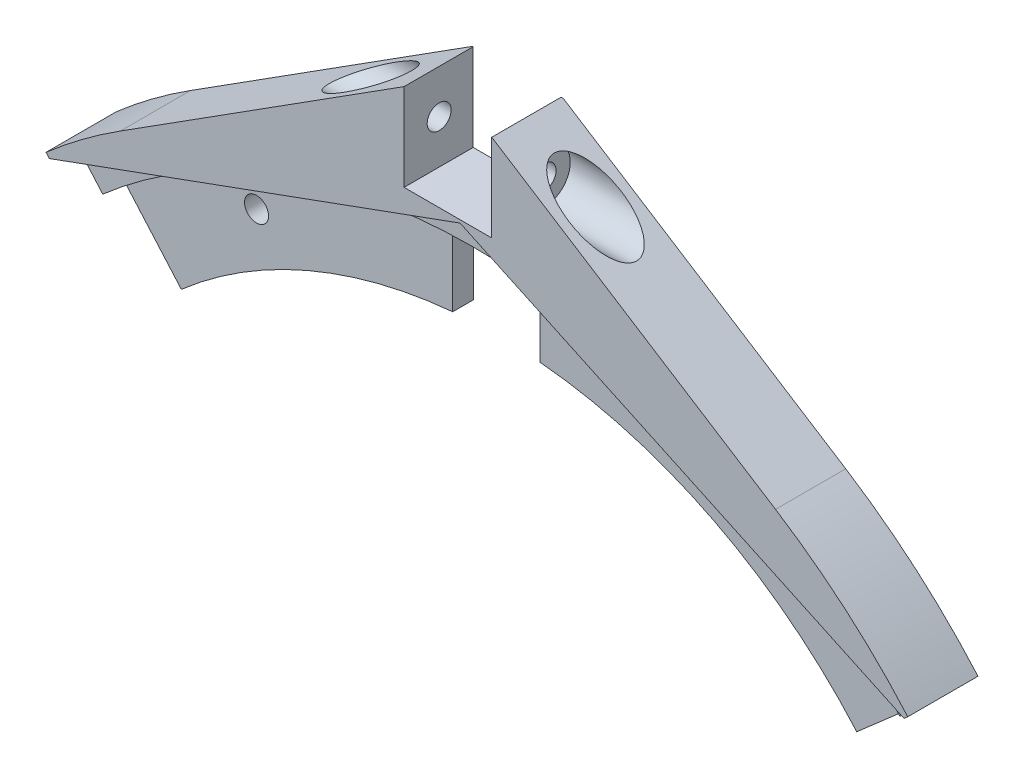
from build123d import *

# Parameters (mm, degrees)
BOSS_EXTRUDE1_DEPTH     = 6.1
BOSS_EXTRUDE4_START     = -5
BOSS_EXTRUDE4_DEPTH     = 5
BOSS_EXTRUDE5_START     = 5
SKETCH6_R               = 2.75
BOSS_EXTRUDE5_DEPTH     = 5
SKETCH7_R               = 2.75
CUT_EXTRUDE1_DEPTH      = 176.534516689
BOSS_EXTRUDE6_START     = -10
BOSS_EXTRUDE6_DEPTH     = 16.1
CUT_EXTRUDE2_DEPTH      = 192.448730864
CUT_EXTRUDE2_DEPTH_BACK = 192.448730864
SKETCH9_W               = 20.1
SKETCH9_H               = 16.057013855
CUT_EXTRUDE3_DEPTH      = 198.16101231
CUT_EXTRUDE3_DEPTH_BACK = 198.16101231
SKETCH10_R              = 2.75
SKETCH11_R              = 6
CUT_EXTRUDE4_DEPTH      = 192.842324158
SKETCH12_R              = 6
CUT_EXTRUDE5_DEPTH      = 200.499981043
CHAMFER1_SIZE           = 0.25


with BuildPart() as part:
    # Sketch4 → Boss-Extrude1 (new body)
    with BuildSketch(Plane.XY):
        with BuildLine():
            Line((2.791805242, 138.827155544), (104.55323324, 91.375022364))
            Line((104.55323324, 91.375022364), (105.415210237, 92.128353131))
            ThreePointArc((105.415210237, 92.128353131), (9.395226761, 139.684393237), (-92.128353131, 105.415210237))
            Line((-92.128353131, 105.415210237), (-91.375022364, 104.55323324))
            Line((-91.375022364, 104.55323324), (2.791805242, 138.827155544))
        make_face()
    extrude(amount=BOSS_EXTRUDE1_DEPTH)

    # Sketch5 → Boss-Extrude4 (add)
    with BuildSketch(Plane.XY.offset(BOSS_EXTRUDE4_START)):
        with BuildLine():
            Line((30.722164617, 125.803015072), (76.622873865, 104.399162835))
            ThreePointArc((76.622873865, 104.399162835), (87.59255508, 95.382358403), (97.50906947, 85.218726646))
            Line((97.50906947, 85.218726646), (105.415210237, 92.128353131))
            ThreePointArc((105.415210237, 92.128353131), (9.395226761, 139.684393237), (-92.128353131, 105.415210237))
            Line((-92.128353131, 105.415210237), (-85.218726646, 97.50906947))
            ThreePointArc((-85.218726646, 97.50906947), (-30.701883618, 125.807966132), (30.722164617, 125.803015072))
        make_face()
    extrude(amount=BOSS_EXTRUDE4_DEPTH)

    # Sketch6 → Boss-Extrude5 (add)
    with BuildSketch(Plane(origin=(0, 0, -5), x_dir=(-1, 0, 0), z_dir=(0, 0, -1)).offset(BOSS_EXTRUDE5_START)):
        with BuildLine():
            Line((-10, 129.5), (10, 129.5))
            Line((10, 129.5), (10, 109.268365161))
            ThreePointArc((10, 109.268365161), (43.208620922, 100.85926186), (72.205596766, 82.619171024))
            Line((72.205596766, 82.619171024), (92.128353131, 105.415210237))
            ThreePointArc((92.128353131, 105.415210237), (-9.395226761, 139.684393237), (-105.415210237, 92.128353131))
            Line((-105.415210237, 92.128353131), (-82.619171024, 72.205596766))
            ThreePointArc((-82.619171024, 72.205596766), (-49.879754516, 97.732214313), (-10, 109.268365161))
            Line((-10, 109.268365161), (-10, 129.5))
        make_face()
        with Locations((54.966796439, 107.162966034)):
            Circle(SKETCH6_R, mode=Mode.SUBTRACT)
    extrude(amount=-BOSS_EXTRUDE5_DEPTH)

    # Sketch7 → Cut-Extrude1 (cut, through all)
    with BuildSketch(Plane.XY):
        with Locations((76.813119358, 91.542310953)):
            Circle(SKETCH7_R)
    extrude(amount=-CUT_EXTRUDE1_DEPTH, mode=Mode.SUBTRACT)

    # Sketch8 → Boss-Extrude6 (add)
    with BuildSketch(Plane.XY.offset(BOSS_EXTRUDE6_START)):
        with BuildLine():
            Line((-10.05, 139.638810866), (-10.05, 159.5))
            Line((-10.05, 159.5), (-75.100690367, 118.15196277))
            ThreePointArc((-75.100690367, 118.15196277), (-43.909921177, 132.935769536), (-10.05, 139.638810866))
        make_face()
        with BuildLine():
            Line((10.05, 139.638810866), (10.05, 159.5))
            Line((10.05, 159.5), (75.100690367, 118.15196277))
            ThreePointArc((75.100690367, 118.15196277), (43.909921177, 132.935769536), (10.05, 139.638810866))
        make_face()
    extrude(amount=BOSS_EXTRUDE6_DEPTH)

    # Sketch9 → Cut-Extrude2 (cut, two sides: drawn at the far end of the back side and taken through both)
    with BuildSketch(Plane.XY.offset(-CUT_EXTRUDE2_DEPTH_BACK)):
        with Locations((0, 147.528506928)):
            Rectangle(SKETCH9_W, SKETCH9_H)
    extrude(amount=CUT_EXTRUDE2_DEPTH + CUT_EXTRUDE2_DEPTH_BACK, mode=Mode.SUBTRACT)

    # Sketch10 → Cut-Extrude3 (cut, two sides: drawn at the far end of the back side and taken through both)
    with BuildSketch(Plane(origin=(-10.05, 0, 0), x_dir=(0, 0, -1), z_dir=(1, 0, 0)).offset(-CUT_EXTRUDE3_DEPTH_BACK)):
        with Locations(Location((1.95, 149.5, 0), (0, 0, 90))):
            Circle(SKETCH10_R)
    extrude(amount=CUT_EXTRUDE3_DEPTH + CUT_EXTRUDE3_DEPTH_BACK, mode=Mode.SUBTRACT)

    # Sketch11 → Cut-Extrude4 (cut, through all)
    with BuildSketch(Plane(origin=(14, 0, 0), x_dir=(0, 0, -1), z_dir=(1, 0, 0))):
        with Locations(Location((1.95, 149.5, 0), (0, 0, 90))):
            Circle(SKETCH11_R)
    extrude(amount=CUT_EXTRUDE4_DEPTH, mode=Mode.SUBTRACT)

    # Sketch12 → Cut-Extrude5 (cut, through all)
    with BuildSketch(Plane(origin=(-14, 0, 0), x_dir=(0, 0, -1), z_dir=(1, 0, 0))):
        with Locations(Location((1.95, 149.5, 0), (0, 0, 90))):
            Circle(SKETCH12_R)
    extrude(amount=-CUT_EXTRUDE5_DEPTH, mode=Mode.SUBTRACT)

    # Chamfer1
    chamfer1_edges = [part.edges().sort_by_distance(p)[0] for p in [
        (0, 139.5, -10),
        (10, 119.384182581, -10),
        (0, 129.5, -10),
        (-10, 119.384182581, -10),
        (10.05, 149.5, -10),
        (-10.05, 149.5, -10),
    ]]
    chamfer(chamfer1_edges, length=CHAMFER1_SIZE)


solid = part.part
